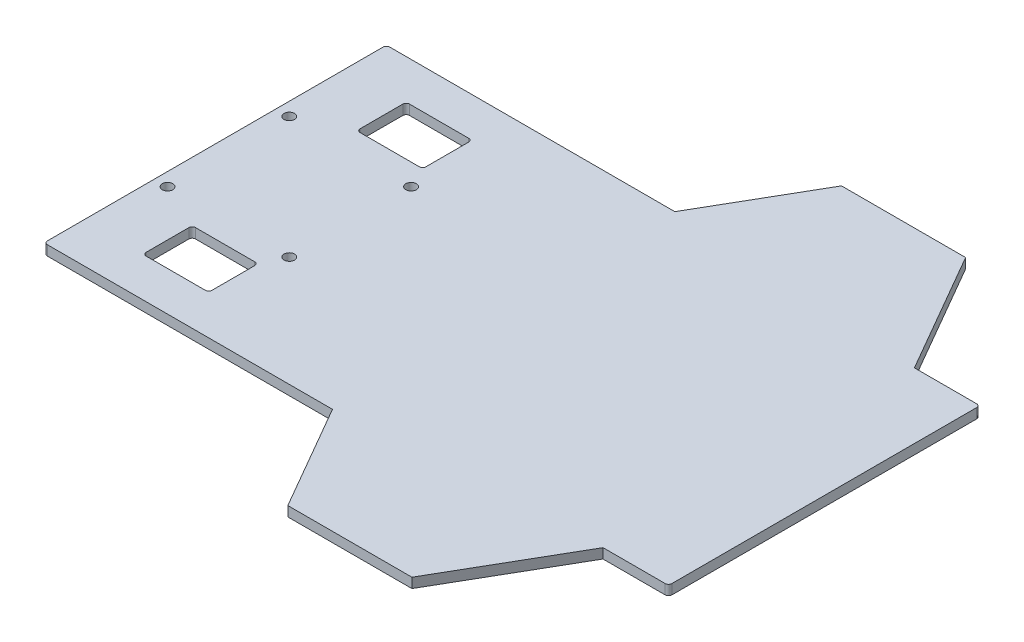
from build123d import *

# Parameters (mm, degrees)
BOSS_EXTRUDE1_DEPTH                        = 3
FILLET1_R                                  = 1
SKETCH2_R                                  = 1.6
MOTOR_DRIVER_HOLES_DEPTH                   = 204.240768548
SKETCH3_W                                  = 20
SKETCH3_H                                  = 15
MOTOR_DRIVER_ROUTING_POCKET_DEPTH          = 204.240768548
MOTOR_DRIVER_ROUTING_POCKET_FILLETS_R      = 1
MOTOR_DRIVER_ROUTING_POCKET_FILLETS_OF_M_R = 1


with BuildPart() as part:
    # Sketch1 → Boss-Extrude1 (new body)
    with BuildSketch(Plane(origin=(0, 0, 0), x_dir=(1, 0, 0), z_dir=(0, 1, 0))):
        Polygon((0, 52), (0, -52), (87.617056359, -52), (106.15, -84.1), (143.85, -84.1), (165.096489906, -47.3), (185, -47.3), (185, 47.3), (165.096489906, 47.3), (143.85, 84.1), (106.15, 84.1), (87.617056359, 52), align=None)
    extrude(amount=BOSS_EXTRUDE1_DEPTH)

    # Fillet1
    fillet1_edges = [part.edges().sort_by_distance(p)[0] for p in [
        (185, 1.5, -47.3),
        (185, 1.5, 47.3),
        (0, 1.5, 52),
        (0, 1.5, -52),
    ]]
    fillet(fillet1_edges, radius=FILLET1_R)

    # Sketch2 → Motor Driver Holes (cut, through all)
    with BuildSketch(Plane(origin=(0, 3, 0), x_dir=(1, 0, 0), z_dir=(0, 1, 0))):
        with Locations(Location((4, 18.5, 0), (0, 0, 270))):
            Circle(SKETCH2_R)
        with Locations(Location((41, 18.5, 0), (0, 0, 270))):
            Circle(SKETCH2_R)
        with Locations(Location((4, -18.5, 0), (0, 0, 270))):
            Circle(SKETCH2_R)
        with Locations(Location((41, -18.5, 0), (0, 0, 270))):
            Circle(SKETCH2_R)
    extrude(amount=-MOTOR_DRIVER_HOLES_DEPTH, mode=Mode.SUBTRACT)

    # Sketch3 → Motor Driver Routing Pocket (cut, through all)
    with BuildSketch(Plane(origin=(0, 3, 0), x_dir=(1, 0, 0), z_dir=(0, 1, 0))):
        with Locations((28, 32.5)):
            Rectangle(SKETCH3_W, SKETCH3_H)
    motor_driver_routing_pocket = extrude(amount=-MOTOR_DRIVER_ROUTING_POCKET_DEPTH, mode=Mode.SUBTRACT)

    # Motor Driver Routing Pocket Fillets
    motor_driver_routing_pocket_fillets_edges = [part.edges().sort_by_distance(p)[0] for p in [
        (38, 1.5, -40),
        (38, 1.5, -25),
        (18, 1.5, -25),
        (18, 1.5, -40),
    ]]
    fillet(motor_driver_routing_pocket_fillets_edges, radius=MOTOR_DRIVER_ROUTING_POCKET_FILLETS_R)

    # Mirror1: Motor Driver Routing Pocket across plane
    add(motor_driver_routing_pocket.mirror(Plane.XY), mode=Mode.SUBTRACT)

    # Motor Driver Routing Pocket Fillets of M
    motor_driver_routing_pocket_fillets_of_m_edges = [part.edges().sort_by_distance(p)[0] for p in [
        (38, 1.5, 40),
        (38, 1.5, 25),
        (18, 1.5, 25),
        (18, 1.5, 40),
    ]]
    fillet(motor_driver_routing_pocket_fillets_of_m_edges, radius=MOTOR_DRIVER_ROUTING_POCKET_FILLETS_OF_M_R)


solid = part.part
